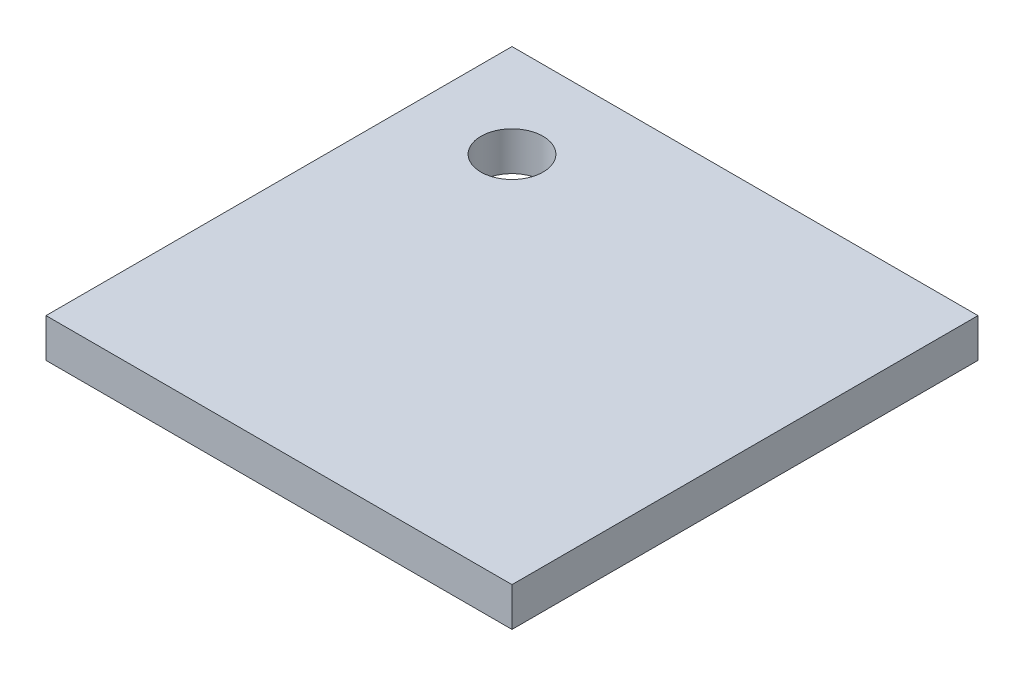
from build123d import *

# Parameters (mm, degrees)
SKETCH_1_W      = 60
SKETCH_1_H      = 60
SKETCH_1_R      = 4
EXTRUDE_1_DEPTH = 5


with BuildPart() as part:
    # 草图1 → 凸台-拉伸1 (new body)
    with BuildSketch(Plane(origin=(0, 0, 0), x_dir=(1, 0, 0), z_dir=(0, 1, 0))):
        with Locations((30, -30)):
            Rectangle(SKETCH_1_W, SKETCH_1_H)
        with Locations(Location((12, -12, 0), (0, 0, 270))):
            Circle(SKETCH_1_R, mode=Mode.SUBTRACT)
    extrude(amount=EXTRUDE_1_DEPTH)


solid = part.part
